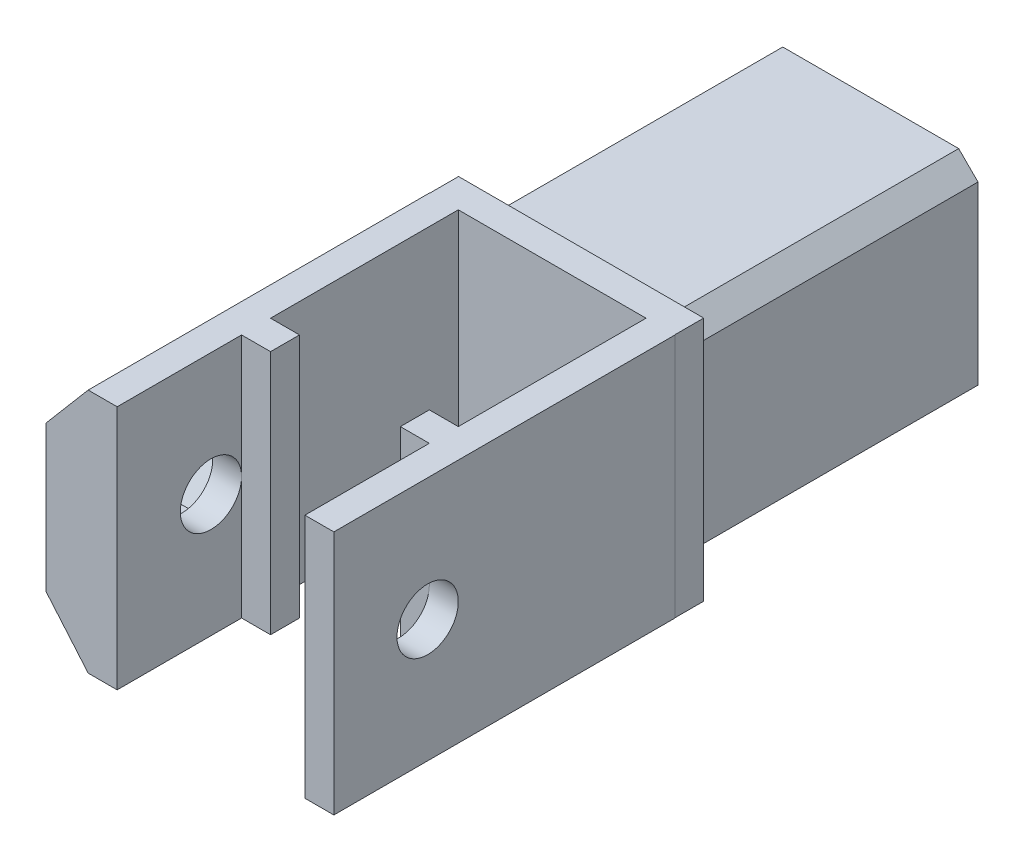
from build123d import *

# Parameters (mm, degrees)
SKETCH1_W               = 22.225
SKETCH1_H               = 22.225
BOSS_EXTRUDE1_DEPTH     = 30
SKETCH3_W               = 25.4
SKETCH3_H               = 25.4
BOSS_EXTRUDE2_DEPTH     = 3
BOSS_EXTRUDE3_DEPTH     = 25.4
BOSS_EXTRUDE4_DEPTH     = 19.43
CUT_EXTRUDE1_DEPTH      = 75.504751526
CUT_EXTRUDE1_DEPTH_BACK = 75.504751526
SKETCH5_R               = 3.175
CUT_EXTRUDE2_DEPTH      = 4.38
CHAMFER1_SIZE           = 2


with BuildPart() as part:
    # Sketch1 → Boss-Extrude1 (new body)
    with BuildSketch(Plane.XY):
        Rectangle(SKETCH1_W, SKETCH1_H)
    extrude(amount=BOSS_EXTRUDE1_DEPTH)

    # Sketch3 → Boss-Extrude2 (add)
    with BuildSketch(Plane.XY.offset(30)):
        Rectangle(SKETCH3_W, SKETCH3_H)
    extrude(amount=BOSS_EXTRUDE2_DEPTH)

    # Sketch4 → Boss-Extrude3 (add)
    with BuildSketch(Plane(origin=(0, 12.7, 0), x_dir=(1, 0, 0), z_dir=(0, 1, 0))):
        Polygon((-12.725, -33), (-12.725, -68.34), (-9.725, -68.34), (-9.725, -55.45), (-6.725, -55.45), (-6.725, -52.45), (-9.725, -52.45), (-9.725, -33), align=None)
        Polygon((9.725, -33), (12.725, -33), (12.725, -68.34), (9.725, -68.34), (9.725, -55.45), (6.725, -55.45), (6.725, -52.45), (9.725, -52.45), align=None)
    extrude(amount=-BOSS_EXTRUDE3_DEPTH)

    # Sketch6 → Boss-Extrude4 (add)
    with BuildSketch(Plane.XY.offset(68.34)):
        Polygon((-12.725, -12.7), (-17.095, -7.555), (-17.095, 7.555), (-12.725, 12.7), align=None)
    extrude(amount=-BOSS_EXTRUDE4_DEPTH)

    # Sketch5 → Cut-Extrude1 (cut, two sides: drawn at the far end of the back side and taken through both)
    with BuildSketch(Plane.ZY.offset(-9.725).offset(-CUT_EXTRUDE1_DEPTH_BACK)):
        with Locations((58.625, 0)):
            Circle(SKETCH5_R)
    extrude(amount=CUT_EXTRUDE1_DEPTH + CUT_EXTRUDE1_DEPTH_BACK, mode=Mode.SUBTRACT)

    # Sketch7 → Cut-Extrude2 (cut)
    with BuildSketch(Plane.ZY.offset(17.095)):
        Polygon((61.976518313, 5.805), (55.273481687, 5.805), (51.921963375, 0), (55.273481687, -5.805), (61.976518313, -5.805), (65.328036625, 0), align=None)
    extrude(amount=-CUT_EXTRUDE2_DEPTH, mode=Mode.SUBTRACT)

    # Chamfer1
    chamfer1_edges = [part.edges().sort_by_distance(p)[0] for p in [
        (11.1125, -11.1125, 15),
        (-11.1125, -11.1125, 15),
        (-11.1125, 11.1125, 15),
        (11.1125, 11.1125, 15),
    ]]
    chamfer(chamfer1_edges, length=CHAMFER1_SIZE)


solid = part.part
